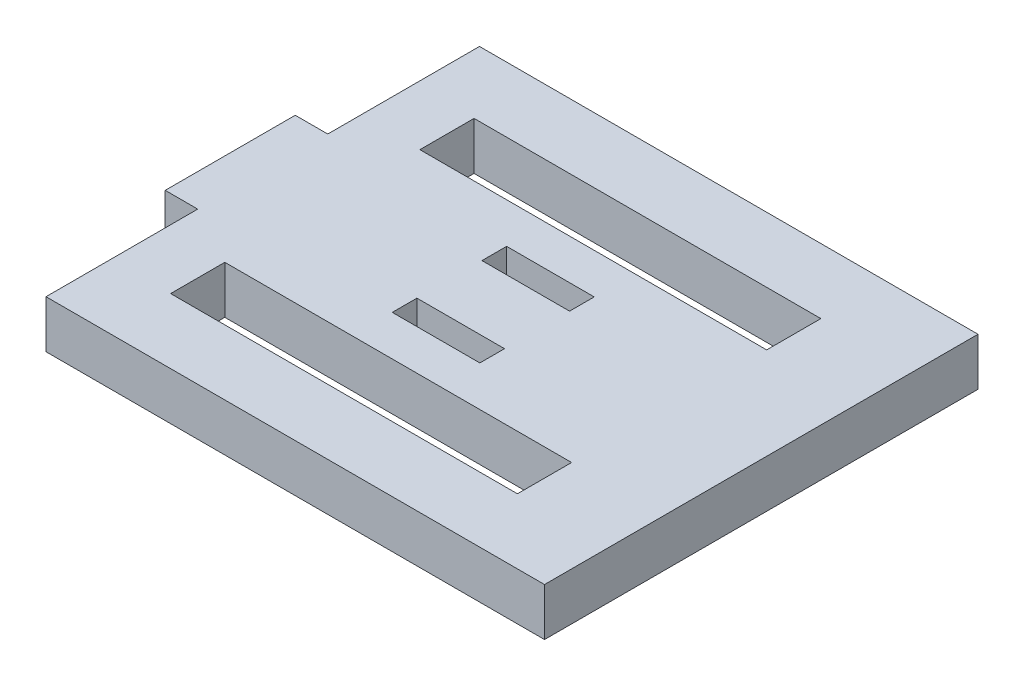
from build123d import *

# Parameters (mm, degrees)
SKETCH1_W           = 16
SKETCH1_H           = 2.5
SKETCH1_W_2         = 4.041280146
SKETCH1_H_2         = 1.13793654
SKETCH1_H_3         = 1.137936541
BOSS_EXTRUDE1_DEPTH = 2.2


with BuildPart() as part:
    # Sketch1 → Boss-Extrude1 (new body)
    with BuildSketch(Plane(origin=(0, 0, 0), x_dir=(1, 0, 0), z_dir=(0, 1, 0))):
        Polygon((-135.695425431, -45.865904239), (-137.195425431, -45.865904239), (-137.195425431, -51.865904239), (-135.695425431, -51.865904239), (-135.695425431, -58.865904239), (-112.695425431, -58.865904239), (-112.695425431, -38.865904239), (-135.695425431, -38.865904239), align=None)
        with Locations((-124.945425431, -54.615904239)):
            Rectangle(SKETCH1_W, SKETCH1_H, mode=Mode.SUBTRACT)
        with Locations((-125.060873132, -50.934872509)):
            Rectangle(SKETCH1_W_2, SKETCH1_H_2, mode=Mode.SUBTRACT)
        with Locations((-125.060873132, -46.796935969)):
            Rectangle(SKETCH1_W_2, SKETCH1_H_3, mode=Mode.SUBTRACT)
        with Locations((-124.945425431, -43.115904239)):
            Rectangle(SKETCH1_W, SKETCH1_H, mode=Mode.SUBTRACT)
    extrude(amount=BOSS_EXTRUDE1_DEPTH)


solid = part.part
